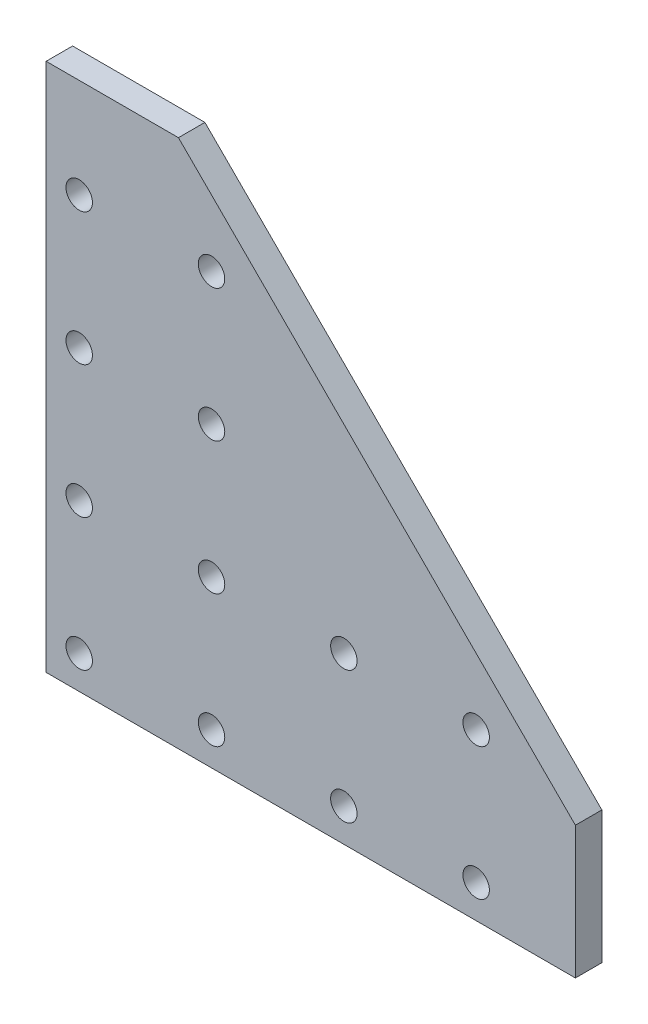
from build123d import *

# Parameters (mm, degrees)
SKETCH1_R           = 4
BOSS_EXTRUDE1_DEPTH = 8


with BuildPart() as part:
    # Sketch1 → Boss-Extrude1 (new body)
    with BuildSketch(Plane.XY):
        Polygon((0, 0), (0, 160), (40, 160), (160, 40), (160, 0), align=None)
        with Locations((10, 10)):
            Circle(SKETCH1_R, mode=Mode.SUBTRACT)
        with Locations((50, 10)):
            Circle(SKETCH1_R, mode=Mode.SUBTRACT)
        with Locations((90, 10)):
            Circle(SKETCH1_R, mode=Mode.SUBTRACT)
        with Locations((10, 90)):
            Circle(SKETCH1_R, mode=Mode.SUBTRACT)
        with Locations((10, 50)):
            Circle(SKETCH1_R, mode=Mode.SUBTRACT)
        with Locations((130, 10)):
            Circle(SKETCH1_R, mode=Mode.SUBTRACT)
        with Locations((10, 130)):
            Circle(SKETCH1_R, mode=Mode.SUBTRACT)
        with Locations((130, 50)):
            Circle(SKETCH1_R, mode=Mode.SUBTRACT)
        with Locations((90, 50)):
            Circle(SKETCH1_R, mode=Mode.SUBTRACT)
        with Locations((50, 50)):
            Circle(SKETCH1_R, mode=Mode.SUBTRACT)
        with Locations((50, 130)):
            Circle(SKETCH1_R, mode=Mode.SUBTRACT)
        with Locations((50, 90)):
            Circle(SKETCH1_R, mode=Mode.SUBTRACT)
    extrude(amount=BOSS_EXTRUDE1_DEPTH)


solid = part.part
